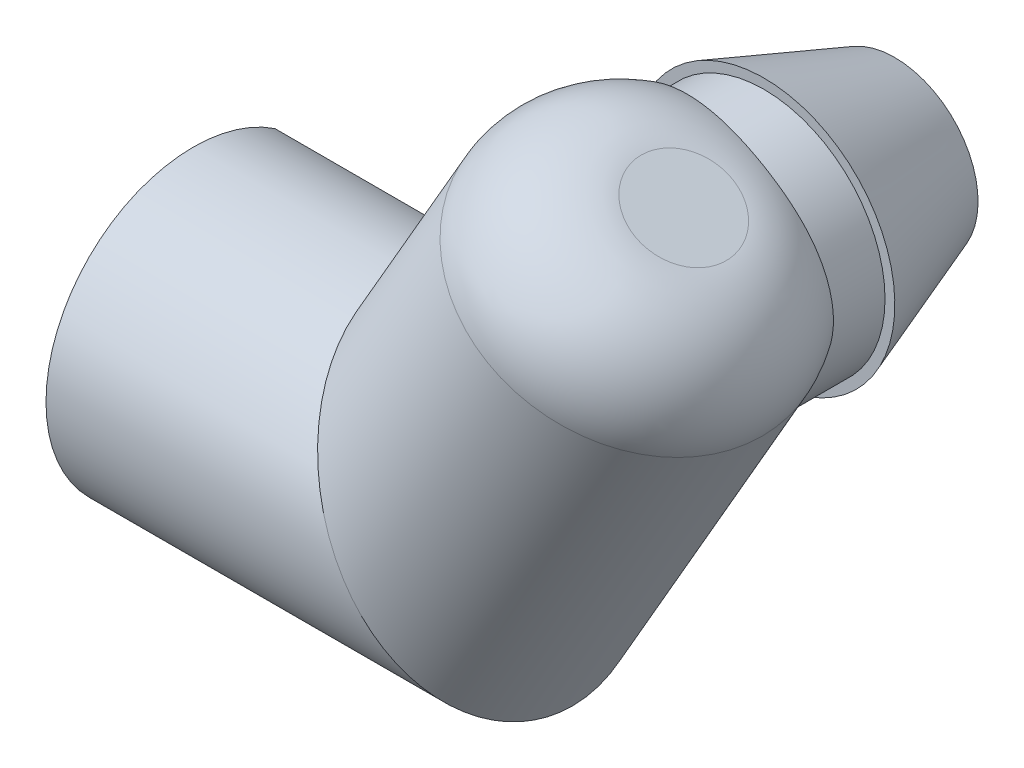
from build123d import *

# Parameters (mm, degrees)
SKETCH3_R           = 2.25
FILLET2_R           = 1.5
SKETCH4_R           = 1.125
SKETCH6_W           = 9.297020352
SKETCH6_H           = 8.256436423
CUT_EXTRUDE1_DEPTH  = 3
SKETCH7_R           = 1.85
BOSS_EXTRUDE2_DEPTH = 1.2
SKETCH8_R           = 2
BOSS_EXTRUDE3_DEPTH = 2
BOSS_EXTRUDE3_TAPER = 20
SKETCH9_R           = 0.85
CUT_EXTRUDE2_DEPTH  = 2.4
SKETCH10_W          = 1.535398486
SKETCH10_H          = 0.7
CUT_EXTRUDE3_DEPTH  = 2.4


with BuildPart() as part:
    # Sweep1: sweep along a path in Sketch2
    with BuildLine(Plane.XY) as sweep1_path:
        Line((-4.5, 0), (0, 0))
        Line((0, 0), (3, 5.196152423))
    # Sketch3 → Sweep1 (sweep)
    with BuildSketch(Plane(origin=(-4.5, 0, 0), x_dir=(0, 0, -1), z_dir=(1, 0, 0))):
        Circle(SKETCH3_R)
    sweep(path=sweep1_path.line, transition=Transition.RIGHT)

    # Fillet2
    fillet2_edges = [part.edges().sort_by_distance(p)[0] for p in [
        (3, 5.196152423, 2.25),
    ]]
    fillet(fillet2_edges, radius=FILLET2_R)

    # Cut-Sweep1: sweep along a path in Sketch5
    with BuildLine(Plane.XY) as cut_sweep1_path:
        Line((-4.5, 0), (1.2, 0))
    # Sketch4 → Cut-Sweep1 (sweep, cut)
    with BuildSketch(Plane.ZY.offset(4.5)):
        Circle(SKETCH4_R)
    sweep(path=cut_sweep1_path.line, mode=Mode.SUBTRACT)

    # Sketch6 → Cut-Extrude1 (cut)
    with BuildSketch(Plane.XY.offset(-1.25)):
        with Locations((-0.019421036, 1.725207659)):
            Rectangle(SKETCH6_W, SKETCH6_H)
    extrude(amount=-CUT_EXTRUDE1_DEPTH, mode=Mode.SUBTRACT)

    # Sketch7 → Boss-Extrude2 (add)
    with BuildSketch(Plane(origin=(0, 0, -1.25), x_dir=(-1, 0, 0), z_dir=(0, 0, -1))):
        with Locations(Location((-1.777414459, 3.078572149, 0), (0, 0, 180))):
            Circle(SKETCH7_R)
    extrude(amount=BOSS_EXTRUDE2_DEPTH)

    # Sketch8 → Boss-Extrude3 (add)
    with BuildSketch(Plane(origin=(0, 0, -2.45), x_dir=(-1, 0, 0), z_dir=(0, 0, -1))):
        with Locations((-1.777414459, 3.078572149)):
            Circle(SKETCH8_R)
    extrude(amount=BOSS_EXTRUDE3_DEPTH, taper=BOSS_EXTRUDE3_TAPER)

    # Sketch9 → Cut-Extrude2 (cut)
    with BuildSketch(Plane(origin=(0, 0, -4.45), x_dir=(-1, 0, 0), z_dir=(0, 0, -1))):
        with Locations((-1.777414459, 3.078572149)):
            Circle(SKETCH9_R)
    extrude(amount=-CUT_EXTRUDE2_DEPTH, mode=Mode.SUBTRACT)

    # Sketch10 → Cut-Extrude3 (cut)
    with BuildSketch(Plane(origin=(0, 0, -4.45), x_dir=(-1, 0, 0), z_dir=(0, 0, -1))):
        with Locations((-0.333609148, 3.11663504)):
            Rectangle(SKETCH10_W, SKETCH10_H)
    extrude(amount=-CUT_EXTRUDE3_DEPTH, mode=Mode.SUBTRACT)


solid = part.part
